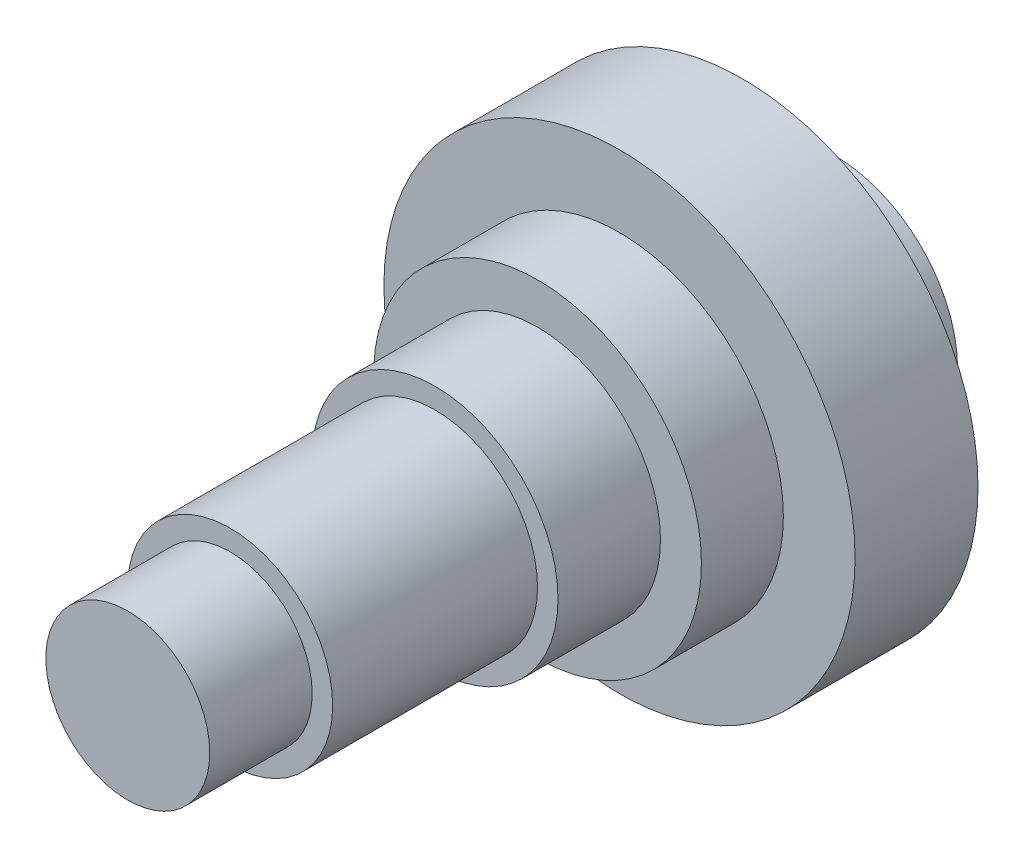
from build123d import *


with BuildPart() as part:
    # Sketch1 → Revolve1 (revolve)
    with BuildSketch(Plane(origin=(0, 0, 0), x_dir=(0, 0, -1), z_dir=(1, 0, 0)), mode=Mode.PRIVATE) as revolve1_sk:
        Polygon((14.3002, 19.05), (0, 19.05), (0, 36.5125), (-19.05, 36.5125), (-19.05, 25.4), (-31.75, 25.4), (-31.75, 19.05), (-47.625, 19.05), (-47.625, 15.875), (-79.375, 15.875), (-79.375, 12.7), (-95.25, 12.7), (-95.25, 0), (14.3002, 0), align=None)
    revolve(revolve1_sk.sketch.rotate(Axis((0, 0, -14.3002), (0, 0, -1)), 90), axis=Axis((0, 0, -14.3002), (0, 0, -1)))


solid = part.part
